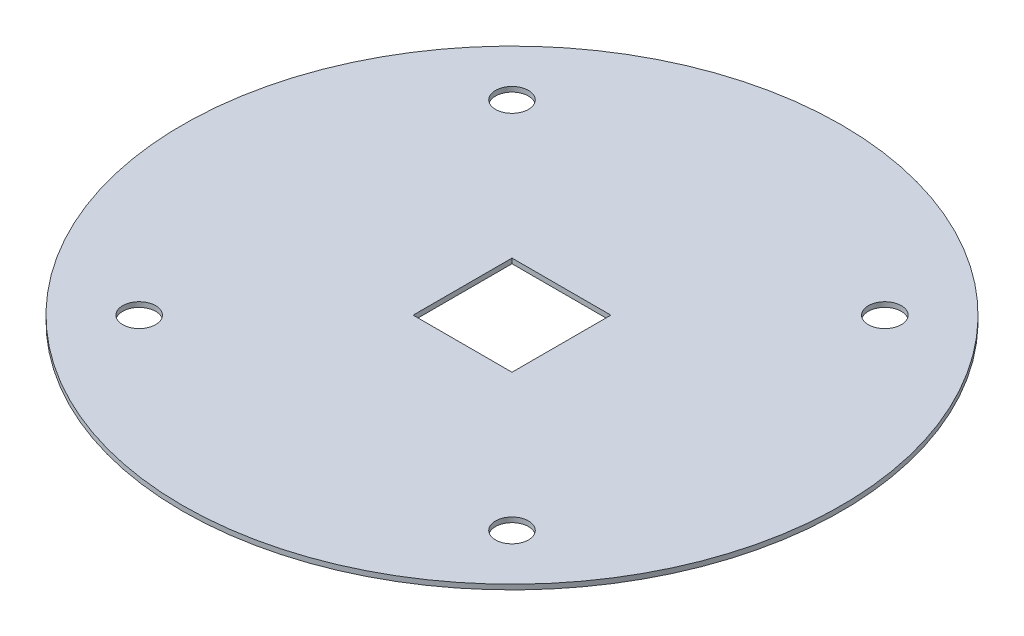
from build123d import *

# Parameters (mm, degrees)
SKETCH_1_R          = 200
EXTRUDE_1_DEPTH     = 3
SKETCH_2_R          = 10
CUT_EXTRUDE_1_DEPTH = 3
SKETCH_3_W          = 60
SKETCH_3_H          = 60
CUT_EXTRUDE_2_DEPTH = 3


with BuildPart() as part:
    # 草图1 → 凸台-拉伸1 (new body)
    with BuildSketch(Plane(origin=(0, 0, 0), x_dir=(1, 0, 0), z_dir=(0, 1, 0))):
        with Locations(Location((0, 0, 0), (0, 0, 270))):
            Circle(SKETCH_1_R)
    extrude(amount=EXTRUDE_1_DEPTH)

    # 草图2 → 切除-拉伸1 (cut)
    with BuildSketch(Plane(origin=(0, 3, 0), x_dir=(1, 0, 0), z_dir=(0, 1, 0))):
        with Locations(Location((-113.13708499, 113.13708499, 0), (0, 0, 270))):
            Circle(SKETCH_2_R)
        with Locations(Location((-113.13708499, -113.13708499, 0), (0, 0, 90))):
            Circle(SKETCH_2_R)
        with Locations(Location((113.13708499, -113.13708499, 0), (0, 0, 270))):
            Circle(SKETCH_2_R)
        with Locations(Location((113.13708499, 113.13708499, 0), (0, 0, 90))):
            Circle(SKETCH_2_R)
    extrude(amount=-CUT_EXTRUDE_1_DEPTH, mode=Mode.SUBTRACT)

    # 草图3 → 切除-拉伸2 (cut)
    with BuildSketch(Plane(origin=(0, 3, 0), x_dir=(1, 0, 0), z_dir=(0, 1, 0))):
        Rectangle(SKETCH_3_W, SKETCH_3_H)
    extrude(amount=-CUT_EXTRUDE_2_DEPTH, mode=Mode.SUBTRACT)


solid = part.part
